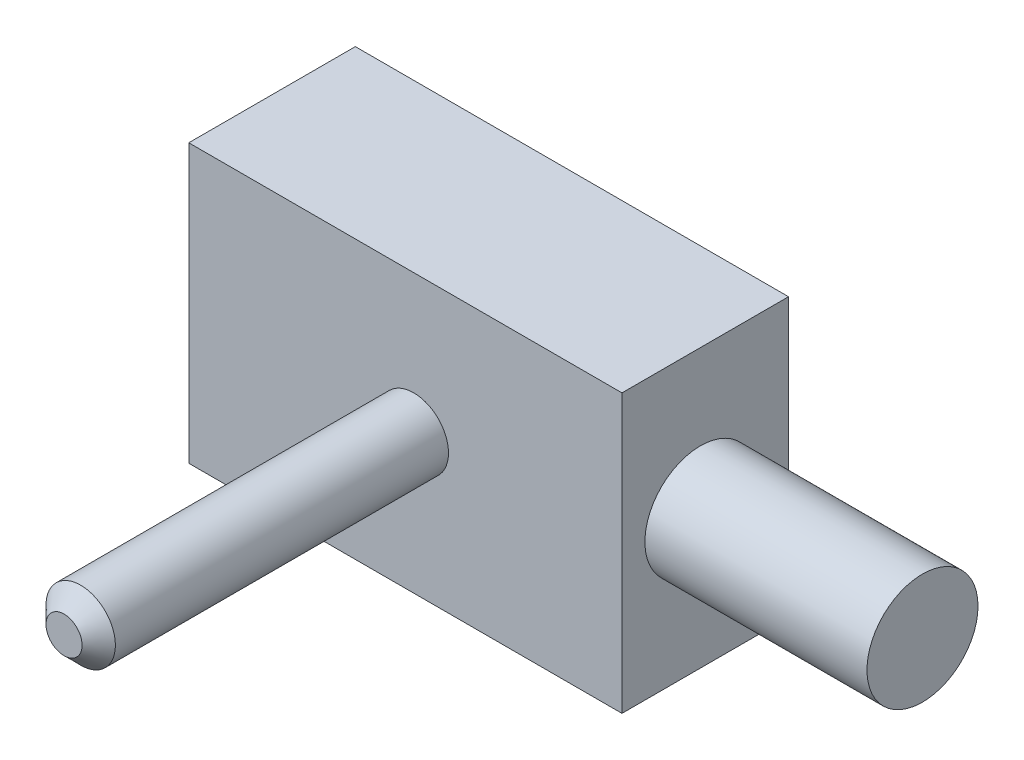
from build123d import *

# Parameters (mm, degrees)
SKETCH1_W           = 78.03
SKETCH1_H           = 50
BOSS_EXTRUDE2_DEPTH = 30
SKETCH2_R           = 10
BOSS_EXTRUDE3_DEPTH = 40
SKETCH3_R           = 6.25
BOSS_EXTRUDE8_DEPTH = 63
CHAMFER6_SIZE       = 3


with BuildPart() as part:
    # Sketch1 → Boss-Extrude2 (new body)
    with BuildSketch(Plane.XY):
        Rectangle(SKETCH1_W, SKETCH1_H)
    extrude(amount=BOSS_EXTRUDE2_DEPTH)

    # Sketch2 → Boss-Extrude3 (add)
    with BuildSketch(Plane(origin=(39.015, 0, 0), x_dir=(0, 0, -1), z_dir=(1, 0, 0))):
        with Locations((-15.87, -0.32)):
            Circle(SKETCH2_R)
    extrude(amount=BOSS_EXTRUDE3_DEPTH)

    # Sketch3 → Boss-Extrude8 (add)
    with BuildSketch(Plane.XY.offset(30)):
        with Locations((1.515, 0)):
            Circle(SKETCH3_R)
    extrude(amount=BOSS_EXTRUDE8_DEPTH)

    # Chamfer6
    chamfer6_edges = [part.edges().sort_by_distance(p)[0] for p in [
        (-4.735, 0, 93),
    ]]
    chamfer(chamfer6_edges, length=CHAMFER6_SIZE)


solid = part.part
